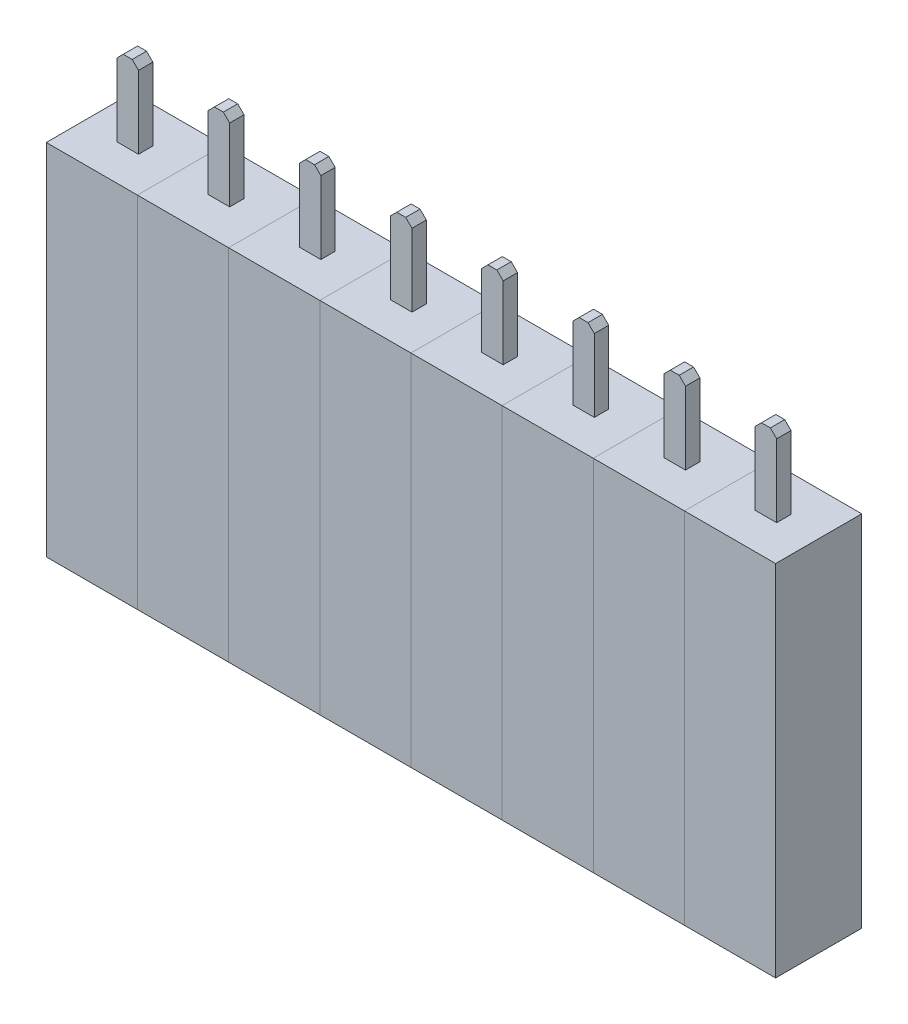
from build123d import *

# Parameters (mm, degrees)
SKETCH1_W           = 2.54
SKETCH1_H           = 10
BOSS_EXTRUDE1_DEPTH = 1.2
SKETCH2_W           = 1.2
SKETCH2_H           = 1.2
CUT_EXTRUDE1_DEPTH  = 7
BOSS_EXTRUDE2_DEPTH = 0.2
LPATTERN1_COUNT     = 8
LPATTERN1_PITCH     = 2.54


with BuildPart() as part:
    # Sketch1 → Boss-Extrude1 (new, symmetric)
    with BuildSketch(Plane.XY):
        Rectangle(SKETCH1_W, SKETCH1_H)
    extrude(amount=BOSS_EXTRUDE1_DEPTH, both=True)

    # Sketch2 → Cut-Extrude1 (cut)
    with BuildSketch(Plane.XZ.offset(5)):
        Rectangle(SKETCH2_W, SKETCH2_H)
    extrude(amount=-CUT_EXTRUDE1_DEPTH, mode=Mode.SUBTRACT)

    # Sketch3 → Boss-Extrude2 (add, symmetric)
    with BuildSketch(Plane.XY):
        Polygon((-0.3, 5), (-0.3, 7.024264069), (-0.124264069, 7.2), (0.124264069, 7.2), (0.3, 7.024264069), (0.3, 5), align=None)
    extrude(amount=BOSS_EXTRUDE2_DEPTH, both=True)


with BuildPart() as lpattern1_1:
    # LPattern1: pattern copy
    add(part.part.moved(Location(Vector(1, 0, 0) * (1 * LPATTERN1_PITCH))))


with BuildPart() as lpattern1_2:
    # LPattern1: pattern copy
    add(part.part.moved(Location(Vector(1, 0, 0) * (2 * LPATTERN1_PITCH))))


with BuildPart() as lpattern1_3:
    # LPattern1: pattern copy
    add(part.part.moved(Location(Vector(1, 0, 0) * (3 * LPATTERN1_PITCH))))


with BuildPart() as lpattern1_4:
    # LPattern1: pattern copy
    add(part.part.moved(Location(Vector(1, 0, 0) * (4 * LPATTERN1_PITCH))))


with BuildPart() as lpattern1_5:
    # LPattern1: pattern copy
    add(part.part.moved(Location(Vector(1, 0, 0) * (5 * LPATTERN1_PITCH))))


with BuildPart() as lpattern1_6:
    # LPattern1: pattern copy
    add(part.part.moved(Location(Vector(1, 0, 0) * (6 * LPATTERN1_PITCH))))


with BuildPart() as lpattern1_7:
    # LPattern1: pattern copy
    add(part.part.moved(Location(Vector(1, 0, 0) * (7 * LPATTERN1_PITCH))))


solid = Compound([part.part, lpattern1_1.part, lpattern1_2.part, lpattern1_3.part, lpattern1_4.part, lpattern1_5.part, lpattern1_6.part, lpattern1_7.part])
